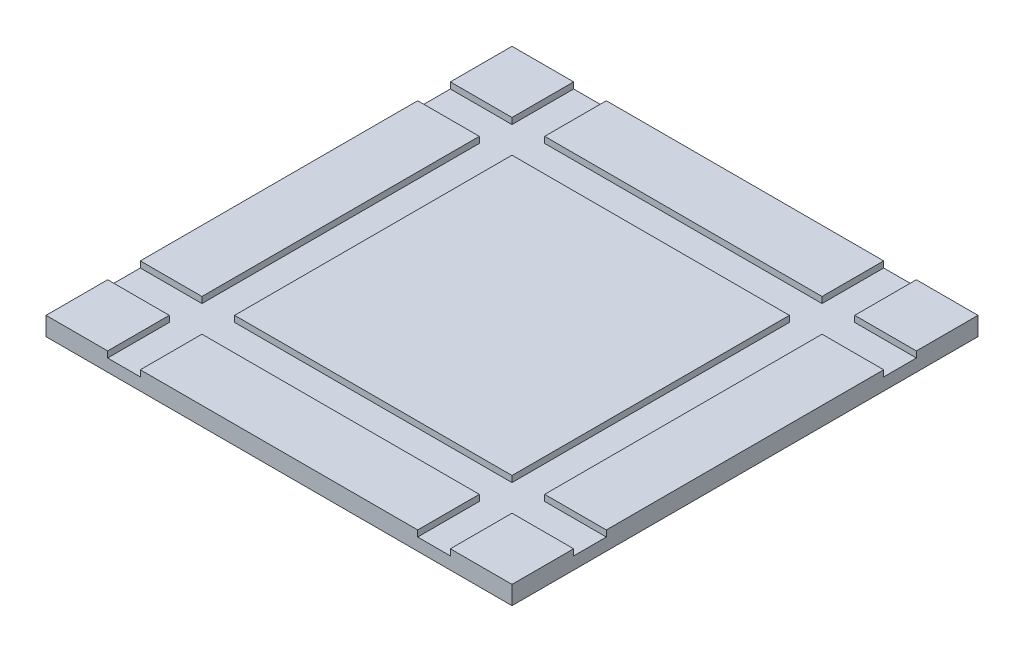
from build123d import *

# Parameters (mm, degrees)
SKETCH1_W           = 75.6
SKETCH1_H           = 75.6
BOSS_EXTRUDE1_DEPTH = 2
SKETCH1_3_W         = 10
SKETCH1_3_H         = 45
SKETCH1_3_H_2       = 10
SKETCH1_3_W_2       = 45
BOSS_EXTRUDE2_DEPTH = 1


with BuildPart() as part:
    # Sketch1 → Boss-Extrude1 (new body)
    with BuildSketch(Plane(origin=(0, 0, 0), x_dir=(1, 0, 0), z_dir=(0, 1, 0))):
        Rectangle(SKETCH1_W, SKETCH1_H)
    extrude(amount=-BOSS_EXTRUDE1_DEPTH)

    # Sketch1<3> → Boss-Extrude2 (add)
    with BuildSketch(Plane(origin=(0, 0, 0), x_dir=(1, 0, 0), z_dir=(0, 1, 0))):
        with Locations((-32.8, 0)):
            Rectangle(SKETCH1_3_W, SKETCH1_3_H)
        with Locations((-32.8, 32.8)):
            Rectangle(SKETCH1_3_W, SKETCH1_3_H_2)
        with Locations((-32.8, -32.8)):
            Rectangle(SKETCH1_3_W, SKETCH1_3_H_2)
        with Locations((0, 32.8)):
            Rectangle(SKETCH1_3_W_2, SKETCH1_3_H_2)
        with Locations((0, -32.8)):
            Rectangle(SKETCH1_3_W_2, SKETCH1_3_H_2)
        with Locations((32.8, 32.8)):
            Rectangle(SKETCH1_3_W, SKETCH1_3_H_2)
        with Locations((32.8, -32.8)):
            Rectangle(SKETCH1_3_W, SKETCH1_3_H_2)
        with Locations((32.8, 0)):
            Rectangle(SKETCH1_3_W, SKETCH1_3_H)
        Rectangle(SKETCH1_3_W_2, SKETCH1_3_H)
    extrude(amount=BOSS_EXTRUDE2_DEPTH)


solid = part.part
